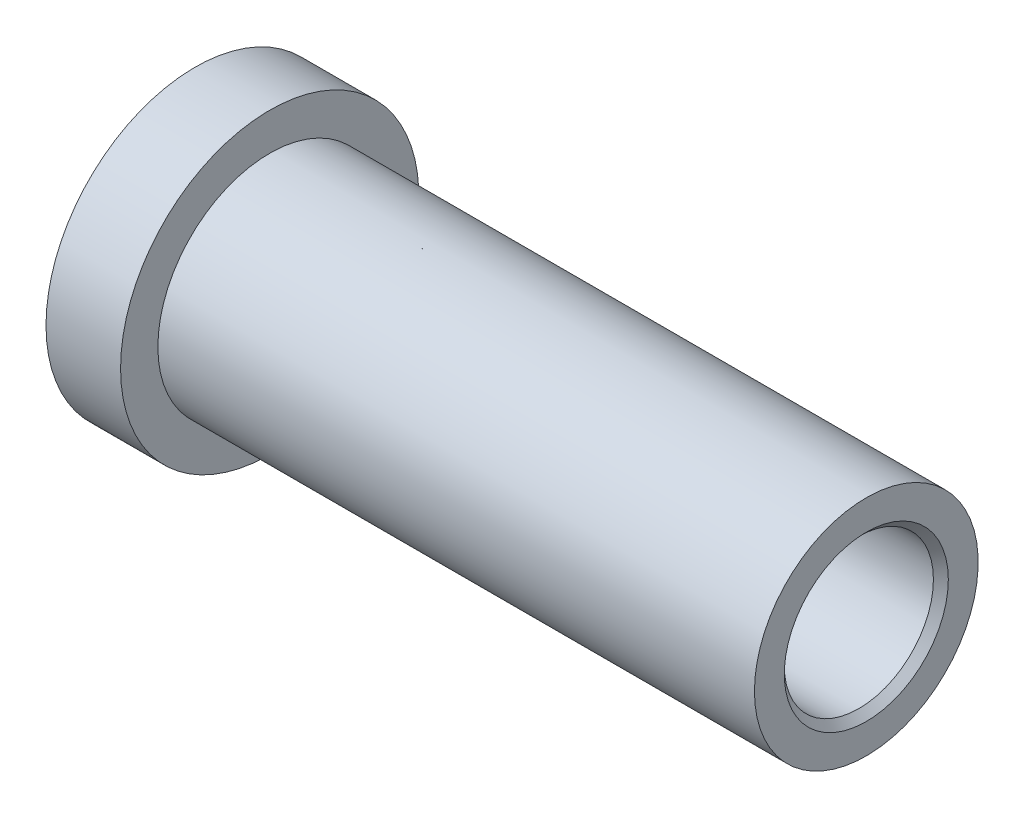
from build123d import *

# Parameters (mm, degrees)
CHAMFER_1_SIZE = 0.5


with BuildPart() as part:
    # Эскиз1 → Повернуть1 (revolve)
    with BuildSketch(Plane.XY, mode=Mode.PRIVATE) as revolve_1_sk:
        Polygon((0, 5), (0, 10), (5, 10), (5, 7.5), (45, 7.5), (45, 5), align=None)
    revolve(revolve_1_sk.sketch.rotate(Axis((0, 0, 0), (1, 0, 0)), 90), axis=Axis((0, 0, 0), (1, 0, 0)))

    # Фаска1
    chamfer_1_edges = [part.edges().sort_by_distance(p)[0] for p in [
        (45, 0, -5),
        (0, 0, -5),
    ]]
    chamfer(chamfer_1_edges, length=CHAMFER_1_SIZE)


solid = part.part
